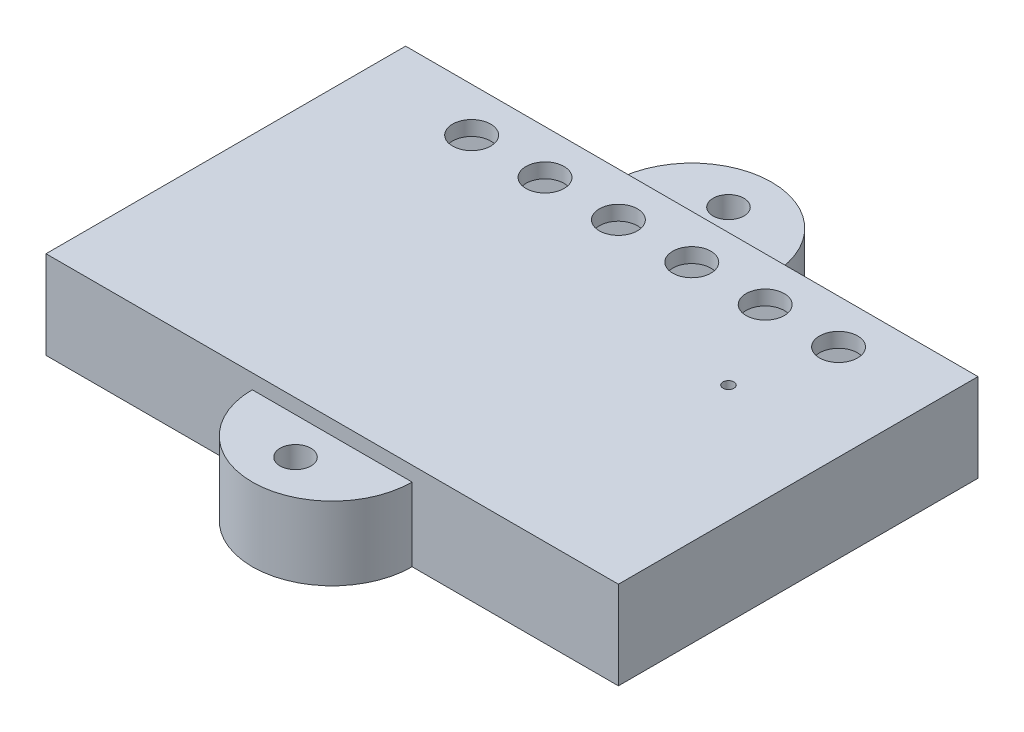
from build123d import *

# Parameters (mm, degrees)
SKETCH2_R           = 2.1
SKETCH2_W           = 72
SKETCH2_H           = 43
BOSS_EXTRUDE1_DEPTH = 10
SKETCH3_W           = 78
SKETCH3_H           = 49
SKETCH3_R           = 2.6
BOSS_EXTRUDE2_DEPTH = 2
SKETCH4_R           = 0.75
CUT_EXTRUDE1_DEPTH  = 10


with BuildPart() as part:
    # Sketch2 → Boss-Extrude1 (new body)
    with BuildSketch(Plane(origin=(0, 0, 0), x_dir=(1, 0, 0), z_dir=(0, 1, 0))):
        with BuildLine():
            Line((-39, 24.5), (-39, 10.89))
            Line((-39, 10.89), (-39, -10.89))
            Line((-39, -10.89), (-39, -24.5))
            Line((-39, -24.5), (-10.89, -24.5))
            ThreePointArc((-10.89, -24.5), (0, -35.39), (10.89, -24.5))
            Line((10.89, -24.5), (39, -24.5))
            Line((39, -24.5), (39, -10.89))
            Line((39, -10.89), (39, 10.89))
            Line((39, 10.89), (39, 24.5))
            Line((39, 24.5), (10.89, 24.5))
            ThreePointArc((10.89, 24.5), (0, 35.39), (-10.89, 24.5))
            Line((-10.89, 24.5), (-39, 24.5))
        make_face()
        with Locations(Location((0, 29.5, 0), (0, 0, 270))):
            Circle(SKETCH2_R, mode=Mode.SUBTRACT)
        with Locations(Location((0, -29.5, 0), (0, 0, 270))):
            Circle(SKETCH2_R, mode=Mode.SUBTRACT)
        Rectangle(SKETCH2_W, SKETCH2_H, mode=Mode.SUBTRACT)
    extrude(amount=BOSS_EXTRUDE1_DEPTH)

    # Sketch3 → Boss-Extrude2 (add)
    with BuildSketch(Plane(origin=(0, 10, 0), x_dir=(1, 0, 0), z_dir=(0, 1, 0))):
        Rectangle(SKETCH3_W, SKETCH3_H)
        with Locations(Location((-24, 18.5, 0), (0, 0, 270))):
            Circle(SKETCH3_R, mode=Mode.SUBTRACT)
        with Locations(Location((-14, 18.5, 0), (0, 0, 270))):
            Circle(SKETCH3_R, mode=Mode.SUBTRACT)
        with Locations(Location((-4, 18.5, 0), (0, 0, 270))):
            Circle(SKETCH3_R, mode=Mode.SUBTRACT)
        with Locations(Location((6, 18.5, 0), (0, 0, 270))):
            Circle(SKETCH3_R, mode=Mode.SUBTRACT)
        with Locations(Location((16, 18.5, 0), (0, 0, 270))):
            Circle(SKETCH3_R, mode=Mode.SUBTRACT)
        with Locations(Location((26, 18.5, 0), (0, 0, 270))):
            Circle(SKETCH3_R, mode=Mode.SUBTRACT)
    extrude(amount=BOSS_EXTRUDE2_DEPTH)

    # Sketch4 → Cut-Extrude1 (cut)
    with BuildSketch(Plane(origin=(0, 12, 0), x_dir=(1, 0, 0), z_dir=(0, 1, 0))):
        with Locations(Location((23, 6.5, 0), (0, 0, 270))):
            Circle(SKETCH4_R)
    extrude(amount=-CUT_EXTRUDE1_DEPTH, mode=Mode.SUBTRACT)


solid = part.part
